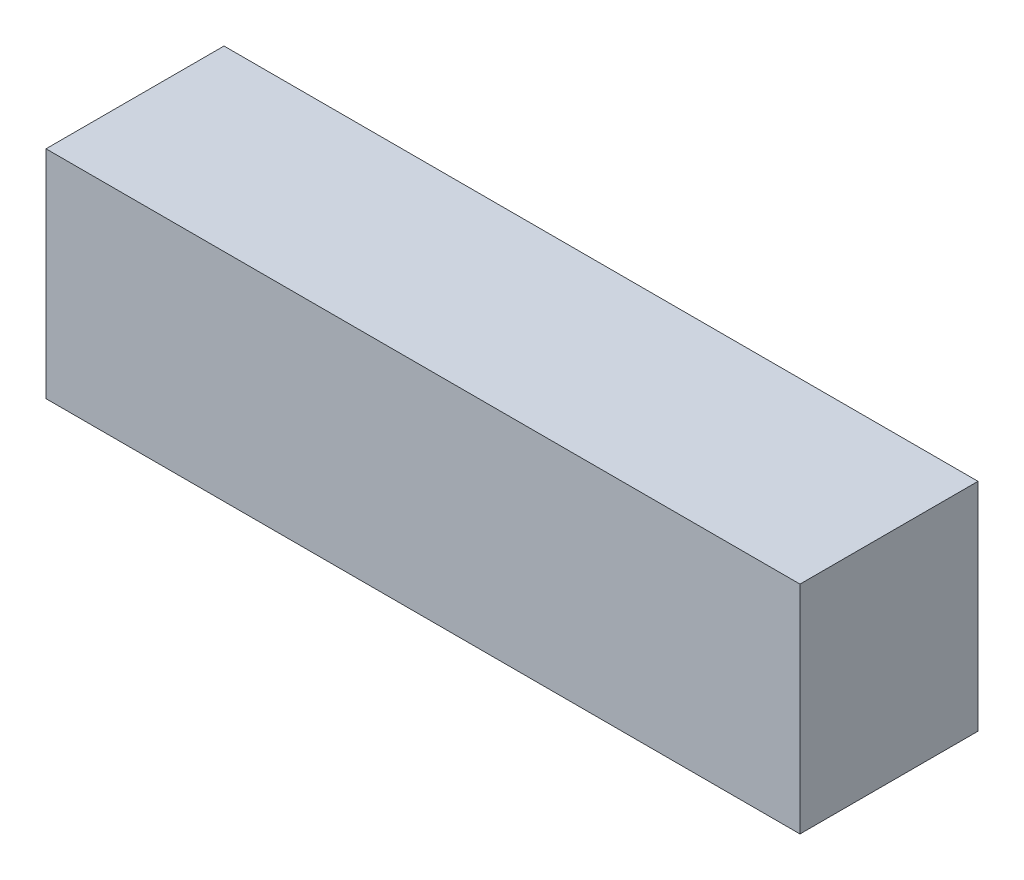
from build123d import *

# Parameters (mm, degrees)
SKETCH1_W           = 108
SKETCH1_H           = 25.5
BOSS_EXTRUDE1_DEPTH = 31


with BuildPart() as part:
    # Sketch1 → Boss-Extrude1 (new body)
    with BuildSketch(Plane(origin=(0, 0, 0), x_dir=(1, 0, 0), z_dir=(0, 1, 0))):
        with Locations((54, 12.75)):
            Rectangle(SKETCH1_W, SKETCH1_H)
    extrude(amount=BOSS_EXTRUDE1_DEPTH)


solid = part.part
